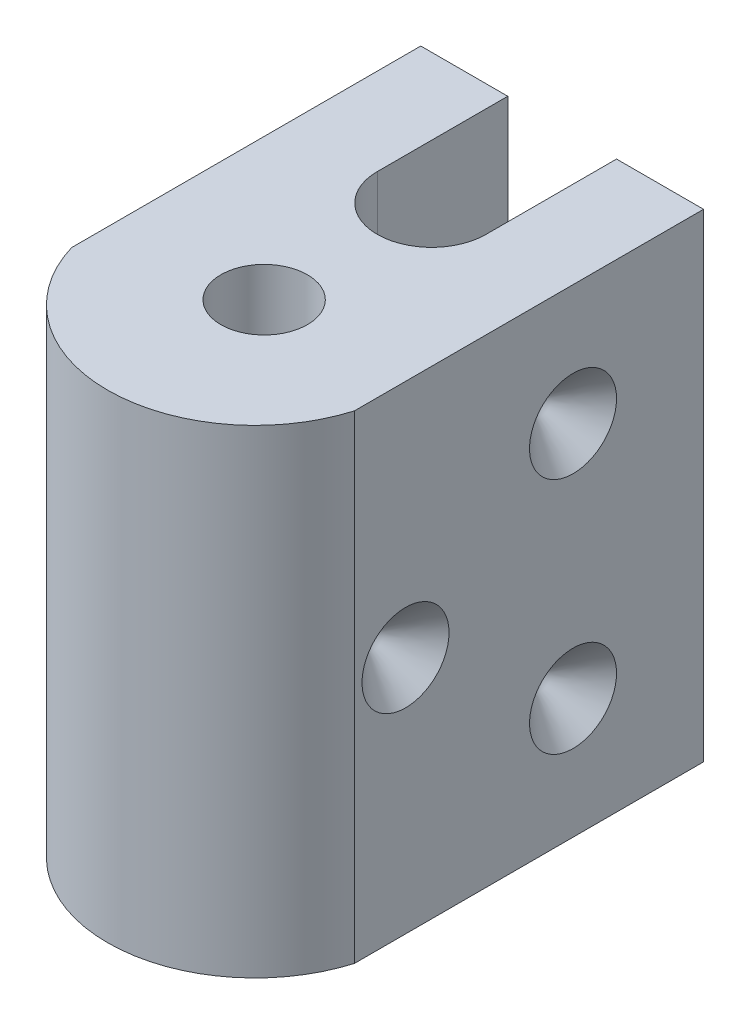
from build123d import *

# Parameters (mm, degrees)
SKETCH1_R           = 1.98968489
BOSS_EXTRUDE2_DEPTH = 22
SKETCH8_W           = 4
SKETCH8_H           = 22
BOSS_EXTRUDE4_DEPTH = 1


with BuildPart() as part:
    # Sketch1 → Boss-Extrude2 (new body)
    with BuildSketch(Plane(origin=(0, 0, 0), x_dir=(1, 0, 0), z_dir=(0, 1, 0))):
        with BuildLine():
            Line((-18.607019748, 0.497178681), (-18.607019748, 5.497178681))
            Line((-18.607019748, 5.497178681), (-14.607019748, 5.497178681))
            Line((-14.607019748, 5.497178681), (-14.607019748, -9.555359754))
            ThreePointArc((-14.607019748, -9.555359754), (-21.107019748, -14.402142963), (-27.607019748, -9.555359754))
            Line((-27.607019748, -9.555359754), (-27.607019748, 5.497178681))
            Line((-27.607019748, 5.497178681), (-23.607019748, 5.497178681))
            Line((-23.607019748, 5.497178681), (-23.607019748, 0.497178681))
            ThreePointArc((-23.607019748, 0.497178681), (-21.107019748, -2.002821319), (-18.607019748, 0.497178681))
        make_face()
        with Locations(Location((-21.107019748, -7.202821319, 0), (0, 0, 270))):
            Circle(SKETCH1_R, mode=Mode.SUBTRACT)
    extrude(amount=BOSS_EXTRUDE2_DEPTH)

    # Sketch8 → Boss-Extrude4 (add)
    with BuildSketch(Plane(origin=(0, 0, -5.497178681), x_dir=(-1, 0, 0), z_dir=(0, 0, -1))):
        with Locations((16.607019748, 11)):
            Rectangle(SKETCH8_W, SKETCH8_H)
        with Locations((25.607019748, 11)):
            Rectangle(SKETCH8_W, SKETCH8_H)
    extrude(amount=BOSS_EXTRUDE4_DEPTH)

    # Cut-Extrude1 cone 1 section (through the dimple's axis) → Cut-Extrude1 (revolve, cut)
    with BuildSketch(Plane(origin=(-14.607019748, 11, 7.202821319), x_dir=(0, 0, -1), z_dir=(0, 1, 0))):
        Polygon((0, 0), (2, 0), (0, 2), align=None)
    revolve(axis=Axis((-14.607019748, 11, 7.202821319), (-1, 0, 0)), mode=Mode.SUBTRACT)

    # Cut-Extrude1 cone 2 section (through the dimple's axis) → Cut-Extrude1 cone 2 (revolve, cut)
    with BuildSketch(Plane(origin=(-14.607019748, 16.470043573, -0.497178681), x_dir=(0, 0, -1), z_dir=(0, 1, 0))):
        Polygon((0, 0), (2, 0), (0, 2), align=None)
    revolve(axis=Axis((-14.607019748, 16.470043573, -0.497178681), (-1, 0, 0)), mode=Mode.SUBTRACT)

    # Cut-Extrude1 cone 3 section (through the dimple's axis) → Cut-Extrude1 cone 3 (revolve, cut)
    with BuildSketch(Plane(origin=(-14.607019748, 5.529956427, -0.497178681), x_dir=(0, 0, -1), z_dir=(0, 1, 0))):
        Polygon((0, 0), (2, 0), (0, 2), align=None)
    revolve(axis=Axis((-14.607019748, 5.529956427, -0.497178681), (-1, 0, 0)), mode=Mode.SUBTRACT)


solid = part.part
